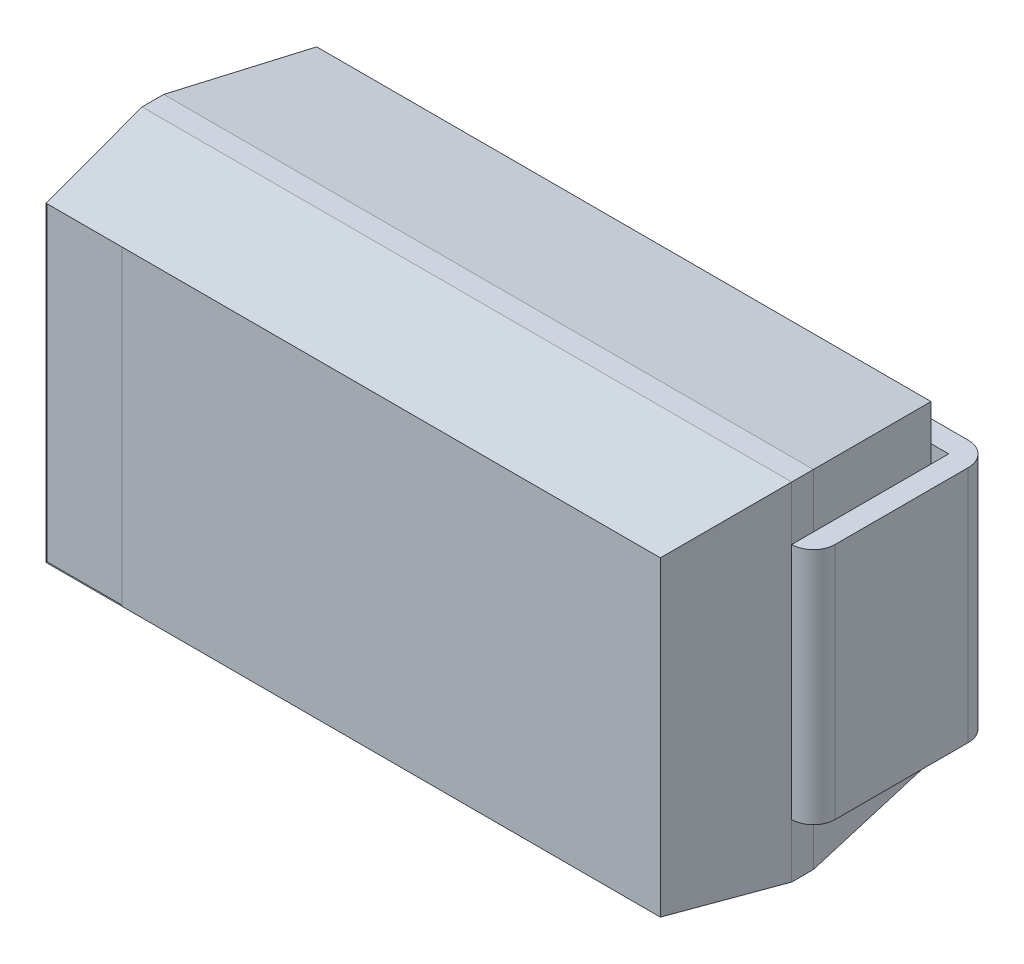
from build123d import *
from OCP.BRepFilletAPI import BRepFilletAPI_MakeChamfer

# Parameters (mm, degrees)
SKETCH_1_W           = 6
SKETCH_1_H           = 3.2
EXTRUDE_1_DEPTH      = 2.5
CHAMFER_1_SIZE       = 1.05
CHAMFER_1_SIZE2      = 0.163
CHAMFER_2_SIZE       = 0.163
CHAMFER_2_SIZE2      = 1.25
EXTRUDE_2_DEPTH      = 1.1
EXTRUDE_2_DEPTH_BACK = 1.1
SKETCH_3_W           = 0.7
SKETCH_3_H           = 2.874
CUT_EXTRUDE_1_DEPTH  = 0.01


with BuildPart() as part:
    # Эскиз1 → Бобышка-Вытянуть1 (new body)
    with BuildSketch(Plane.XY.offset(0.2)):
        Rectangle(SKETCH_1_W, SKETCH_1_H)
    extrude(amount=EXTRUDE_1_DEPTH)

    # Фаска1: one chamfer whose edges measure the first distance from different faces: ONE call of the kernel's chamfer builder (chamfer() names one face for all edges)
    chamfer_1_edges_1 = [part.edges().sort_by_distance(p)[0] for p in [
        (-3, 0, 2.7),
    ]]
    chamfer_1_side_1 = [part.faces().sort_by_distance(p)[0] for p in [
        (-3, 0, 1.45),
    ]]
    chamfer_1_edges_2 = [part.edges().sort_by_distance(p)[0] for p in [
        (0, -1.6, 2.7),
    ]]
    chamfer_1_side_2 = [part.faces().sort_by_distance(p)[0] for p in [
        (0, -1.6, 1.45),
    ]]
    chamfer_1_edges_3 = [part.edges().sort_by_distance(p)[0] for p in [
        (3, 0, 2.7),
    ]]
    chamfer_1_side_3 = [part.faces().sort_by_distance(p)[0] for p in [
        (3, 0, 1.45),
    ]]
    chamfer_1_edges_4 = [part.edges().sort_by_distance(p)[0] for p in [
        (0, 1.6, 2.7),
    ]]
    chamfer_1_side_4 = [part.faces().sort_by_distance(p)[0] for p in [
        (0, 1.6, 1.45),
    ]]
    chamfer_1 = BRepFilletAPI_MakeChamfer(part.part.solid().wrapped)
    for e in chamfer_1_edges_1:
        chamfer_1.Add(CHAMFER_1_SIZE, CHAMFER_1_SIZE2, e.wrapped, chamfer_1_side_1[0].wrapped)  # the first distance lies on this face
    for e in chamfer_1_edges_2:
        chamfer_1.Add(CHAMFER_1_SIZE, CHAMFER_1_SIZE2, e.wrapped, chamfer_1_side_2[0].wrapped)  # the first distance lies on this face
    for e in chamfer_1_edges_3:
        chamfer_1.Add(CHAMFER_1_SIZE, CHAMFER_1_SIZE2, e.wrapped, chamfer_1_side_3[0].wrapped)  # the first distance lies on this face
    for e in chamfer_1_edges_4:
        chamfer_1.Add(CHAMFER_1_SIZE, CHAMFER_1_SIZE2, e.wrapped, chamfer_1_side_4[0].wrapped)  # the first distance lies on this face
    add(Compound.cast(chamfer_1.Shape()), mode=Mode.REPLACE)

    # Фаска2
    chamfer_2_edges = [part.edges().sort_by_distance(p)[0] for p in [
        (0, -1.6, 0.2),
        (-3, 0, 0.2),
        (0, 1.6, 0.2),
        (3, 0, 0.2),
    ]]
    chamfer_2_side = [part.faces().sort_by_distance(p)[0] for p in [
        (0, 0, 0.2),
    ]]
    chamfer(chamfer_2_edges, length=CHAMFER_2_SIZE, length2=CHAMFER_2_SIZE2, reference=chamfer_2_side[0])

    # Эскиз3 → Вырез-Вытянуть1 (cut)
    with BuildSketch(Plane.XY.offset(2.7)):
        with Locations((-2.487, 0)):
            Rectangle(SKETCH_3_W, SKETCH_3_H)
    extrude(amount=-CUT_EXTRUDE_1_DEPTH, mode=Mode.SUBTRACT)


with BuildPart() as body_2:
    # Эскиз2 → Бобышка-Вытянуть2 (new, two sides: drawn at the far end of the back side and taken through both)
    with BuildSketch(Plane(origin=(0, 0, 0), x_dir=(1, 0, 0), z_dir=(0, 1, 0)).offset(-EXTRUDE_2_DEPTH_BACK)):
        with BuildLine():
            Line((-3, -0.2), (-3, -1.45))
            Line((-3, -1.45), (-3, -1.65))
            ThreePointArc((-3, -1.65), (-3.141421356, -1.591421356), (-3.2, -1.45))
            Line((-3.2, -1.45), (-3.2, -0.22))
            ThreePointArc((-3.2, -0.22), (-3.135563492, -0.064436508), (-2.98, 0))
            Line((-2.98, 0), (-1.9, 0))
            Line((-1.9, 0), (-1.9, -0.2))
            Line((-1.9, -0.2), (-3, -0.2))
        make_face()
    extrude(amount=EXTRUDE_2_DEPTH + EXTRUDE_2_DEPTH_BACK)


with BuildPart() as body_3:
    # Зеркальное отражение1: mirrored copy
    add(body_2.part.mirror(Plane(origin=(0, 0, 0), x_dir=(0, 0, 1), z_dir=(1, 0, 0))))


solid = Compound([part.part, body_2.part, body_3.part])
